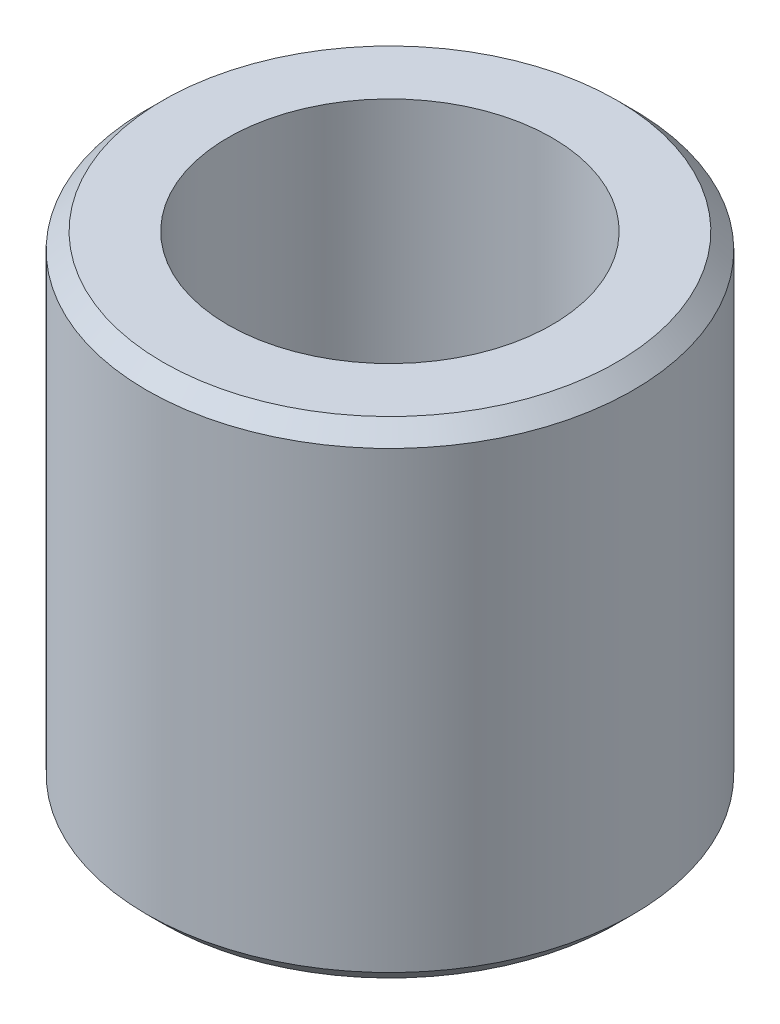
from build123d import *

# Parameters (mm, degrees)
SKETCH1_R           = 15
BOSS_EXTRUDE2_DEPTH = 15
SKETCH2_R           = 10
CUT_EXTRUDE1_DEPTH  = 36
CHAMFER2_SIZE       = 1


with BuildPart() as part:
    # Sketch1 → Boss-Extrude2 (new, symmetric)
    with BuildSketch(Plane(origin=(0, 0, 0), x_dir=(1, 0, 0), z_dir=(0, 1, 0))):
        with Locations(Location((0, 0, 0), (0, 0, 270))):
            Circle(SKETCH1_R)
    extrude(amount=BOSS_EXTRUDE2_DEPTH, both=True)

    # Sketch2 → Cut-Extrude1 (cut)
    with BuildSketch(Plane.XZ.offset(15)):
        with Locations(Location((0, 0, 0), (0, 0, 270))):
            Circle(SKETCH2_R)
    extrude(amount=-CUT_EXTRUDE1_DEPTH, mode=Mode.SUBTRACT)

    # Chamfer2
    chamfer2_edges = [part.edges().sort_by_distance(p)[0] for p in [
        (0, -15, -15),
        (0, 15, -15),
    ]]
    chamfer(chamfer2_edges, length=CHAMFER2_SIZE)


solid = part.part
